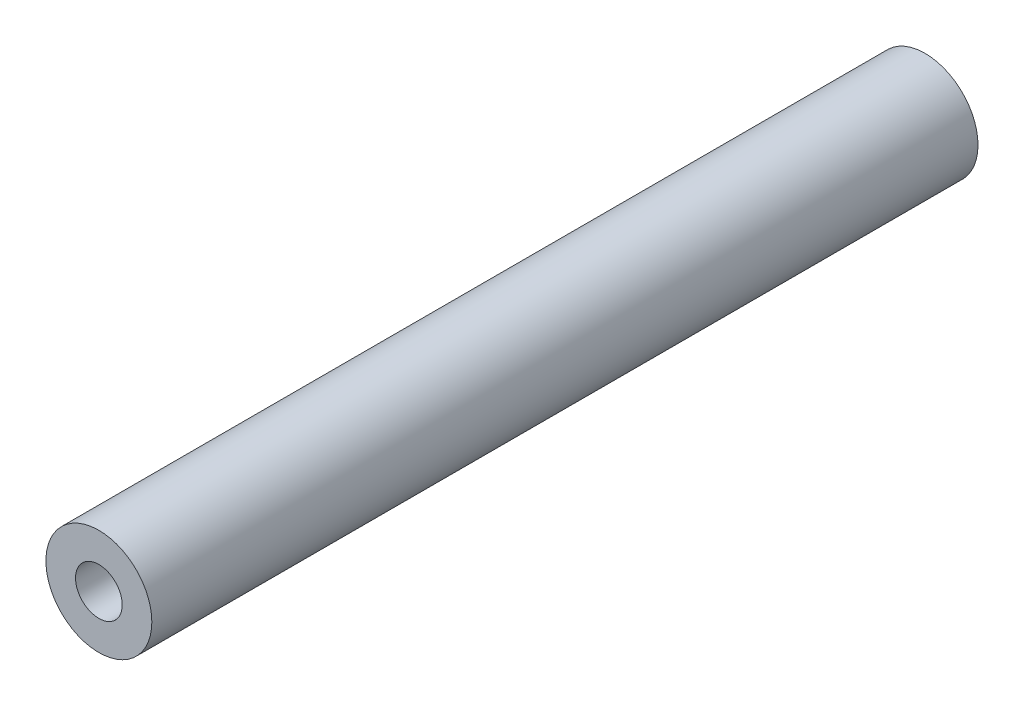
from build123d import *

# Parameters (mm, degrees)
BOSS_EXTRUDE1_DEPTH      = 37.1475
BOSS_EXTRUDE1_DEPTH_BACK = 37.1475
SKETCH3_R                = 4.7625


with BuildPart() as part:
    # Sketch3 → Boss-Extrude1 (new, two sides: drawn at the far end of the back side and taken through both)
    with BuildSketch(Plane.XY.offset(-BOSS_EXTRUDE1_DEPTH_BACK)):
        Circle(SKETCH3_R)
    extrude(amount=BOSS_EXTRUDE1_DEPTH + BOSS_EXTRUDE1_DEPTH_BACK)

    # Sketch6 → Tap Drill for M5x0.8 Tap1 (revolve, cut)
    with BuildSketch(Plane(origin=(0, 0, 37.1475), x_dir=(0, -1, 0), z_dir=(1, 0, 0))):
        Polygon((0, 0), (0, 13.9618073), (2.1, 12.7), (2.1, 0), align=None)
    tap_drill_for_m5x0_8_tap1 = revolve(axis=Axis((0, 0, 43.4975), (0, 0, -1)), mode=Mode.SUBTRACT)

    # Mirror1: Tap Drill for M5x0.8 Tap1 across plane
    add(tap_drill_for_m5x0_8_tap1.mirror(Plane.XY), mode=Mode.SUBTRACT)


solid = part.part
